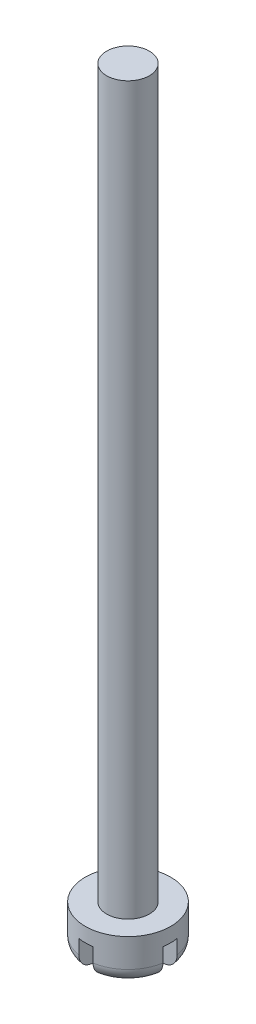
from build123d import *

# Parameters (mm, degrees)
ESQUISSE1_R             = 1.5
BOSS_EXTRU_1_DEPTH      = 1.5
ESQUISSE2_R             = 0.75
BOSS_EXTRU_2_DEPTH      = 25.5
ESQUISSE3_W             = 0.5
ESQUISSE3_H             = 0.5
ENL_V_MAT_EXTRU_1_DEPTH = 1
CONG_1_R                = 0.5


with BuildPart() as part:
    # Esquisse1 → Boss.-Extru.1 (new body)
    with BuildSketch(Plane.XZ.offset(1.5)):
        with Locations(Location((-17.069271079, 10.656506254, 0), (0, 0, 270))):
            Circle(ESQUISSE1_R)
    extrude(amount=-BOSS_EXTRU_1_DEPTH)

    # Esquisse2 → Boss.-Extru.2 (add)
    with BuildSketch(Plane(origin=(0, 0, 0), x_dir=(1, 0, 0), z_dir=(0, 1, 0))):
        with Locations(Location((-17.069271079, -10.656506254, 0), (0, 0, 90))):
            Circle(ESQUISSE2_R)
    extrude(amount=BOSS_EXTRU_2_DEPTH)

    # Esquisse3 → Enlèv. mat.-Extru.1 (cut)
    with BuildSketch(Plane.XZ.offset(1.5)):
        with BuildLine():
            Line((-16.819271079, 9.177486308), (-16.819271079, 10.406506254))
            Line((-16.819271079, 10.406506254), (-17.319271079, 10.406506254))
            Line((-17.319271079, 10.406506254), (-17.319271079, 9.177486308))
            ThreePointArc((-17.319271079, 9.177486308), (-17.069271079, 9.156506254), (-16.819271079, 9.177486308))
        make_face()
        with BuildLine():
            Line((-16.819271079, 10.906506254), (-16.819271079, 12.1355262))
            ThreePointArc((-16.819271079, 12.1355262), (-17.069271079, 12.156506254), (-17.319271079, 12.1355262))
            Line((-17.319271079, 12.1355262), (-17.319271079, 10.906506254))
            Line((-17.319271079, 10.906506254), (-16.819271079, 10.906506254))
        make_face()
        with BuildLine():
            Line((-15.590251133, 10.906506254), (-16.819271079, 10.906506254))
            Line((-16.819271079, 10.906506254), (-16.819271079, 10.406506254))
            Line((-16.819271079, 10.406506254), (-15.590251133, 10.406506254))
            ThreePointArc((-15.590251133, 10.406506254), (-15.574525295, 10.531066863), (-15.569271079, 10.656506254))
            ThreePointArc((-15.569271079, 10.656506254), (-15.574525295, 10.781945644), (-15.590251133, 10.906506254))
        make_face()
        with BuildLine():
            Line((-17.319271079, 10.406506254), (-17.319271079, 10.906506254))
            Line((-17.319271079, 10.906506254), (-18.548291025, 10.906506254))
            ThreePointArc((-18.548291025, 10.906506254), (-18.569271079, 10.656506254), (-18.548291025, 10.406506254))
            Line((-18.548291025, 10.406506254), (-17.319271079, 10.406506254))
        make_face()
        with Locations((-17.069271079, 10.656506254)):
            Rectangle(ESQUISSE3_W, ESQUISSE3_H)
    extrude(amount=-ENL_V_MAT_EXTRU_1_DEPTH, mode=Mode.SUBTRACT)

    # Congé1
    cong_1_edges = [part.edges().sort_by_distance(p)[0] for p in [
        (-16.008610907, -1.5, 11.717166426),
        (-18.129931251, -1.5, 11.717166426),
        (-18.129931251, -1.5, 9.595846082),
        (-16.008610907, -1.5, 9.595846082),
    ]]
    fillet(cong_1_edges, radius=CONG_1_R)


solid = part.part
